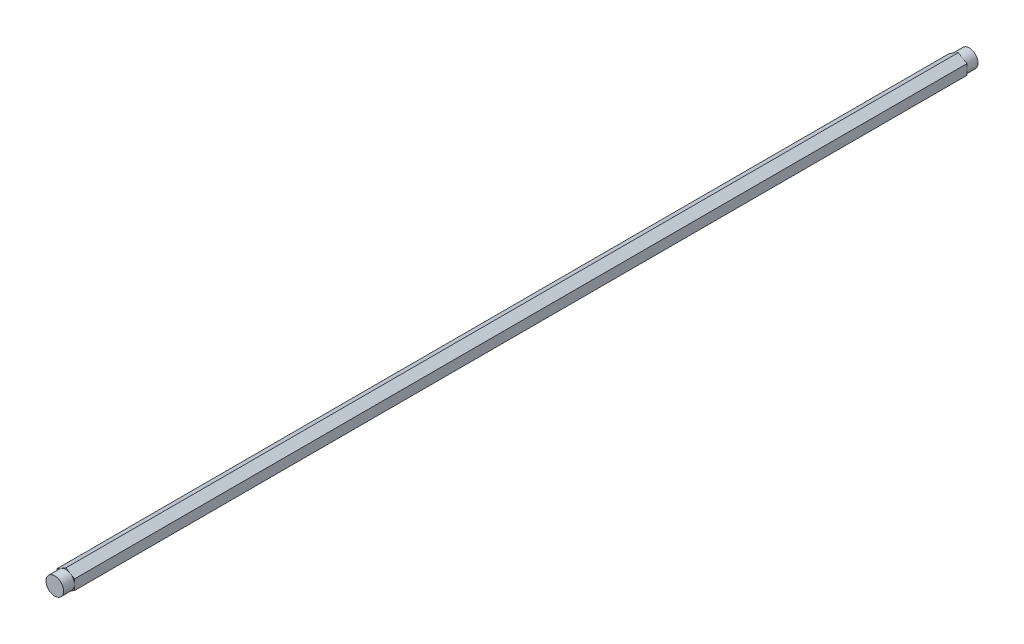
from build123d import *

# Parameters (mm, degrees)
BOSS_EXTRUDE1_DEPTH     = 330.2
SKETCH2_R               = 8.89
SKETCH2_R_2             = 6.35
CUT_EXTRUDE_THIN1_DEPTH = 7.9375


with BuildPart() as part:
    # Sketch1 → Boss-Extrude1 (new, symmetric)
    with BuildSketch(Plane.XY):
        Polygon((0, 7.332348419), (-6.35, 3.666174209), (-6.35, -3.666174209), (0, -7.332348419), (6.35, -3.666174209), (6.35, 3.666174209), align=None)
    extrude(amount=BOSS_EXTRUDE1_DEPTH, both=True)

    # Sketch2 → Cut-Extrude-Thin1 (cut)
    with BuildSketch(Plane(origin=(0, 0, -330.2), x_dir=(-1, 0, 0), z_dir=(0, 0, -1))):
        Circle(SKETCH2_R)
        Circle(SKETCH2_R_2, mode=Mode.SUBTRACT)
    cut_extrude_thin1 = extrude(amount=-CUT_EXTRUDE_THIN1_DEPTH, mode=Mode.SUBTRACT)

    # Mirror1: Cut-Extrude-Thin1 across plane
    add(cut_extrude_thin1.mirror(Plane.XY), mode=Mode.SUBTRACT)


solid = part.part
